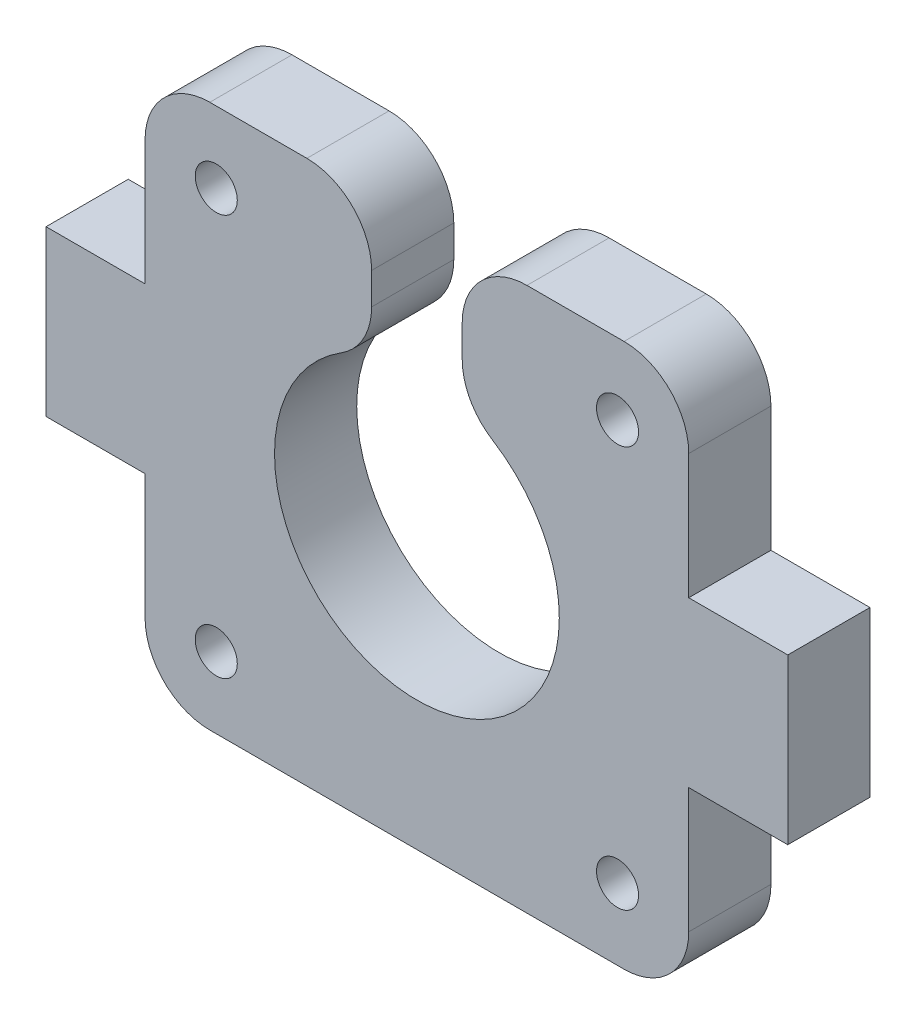
from build123d import *

# Parameters (mm, degrees)
SKETCH1_W                   = 57.3
SKETCH1_H                   = 42
BOSS_EXTRUDE1_DEPTH         = 6.35
TAP_DRILL_FOR_M3X0_5_TAP1_D = 3.25
CUT_EXTRUDE1_DEPTH          = 37.085246293
SKETCH5_W                   = 7.65
SKETCH5_H                   = 14.65
CUT_EXTRUDE2_DEPTH          = 37.085246293
FILLET1_R                   = 5


with BuildPart() as part:
    # Sketch1 → Boss-Extrude1 (new body)
    with BuildSketch(Plane.XY):
        Rectangle(SKETCH1_W, SKETCH1_H)
    extrude(amount=BOSS_EXTRUDE1_DEPTH)

    # Tap Drill for M3x0.5 Tap1 (through all)
    with Locations(Plane.XY.offset(6.35)):
        with Locations((15.5, 15.5), (15.5, -15.5), (-15.5, 15.5), (-15.5, -15.5)):
            Hole(TAP_DRILL_FOR_M3X0_5_TAP1_D / 2)

    # Sketch4 → Cut-Extrude1 (cut, through all)
    with BuildSketch(Plane.XY.offset(6.35)):
        with BuildLine():
            ThreePointArc((11, 0), (8.93028555, 6.422616289), (3.5, 10.428326807))
            Line((3.5, 10.428326807), (-3.5, 10.428326807))
            ThreePointArc((-3.5, 10.428326807), (-6.422616289, -8.93028555), (11, 0))
        make_face()
        with BuildLine():
            Line((-3.5, 10.428326807), (3.5, 10.428326807))
            ThreePointArc((3.5, 10.428326807), (0, 11), (-3.5, 10.428326807))
        make_face()
        with BuildLine():
            ThreePointArc((-3.5, 10.428326807), (0, 11), (3.5, 10.428326807))
            Line((3.5, 10.428326807), (3.5, 21))
            Line((3.5, 21), (-3.5, 21))
            Line((-3.5, 21), (-3.5, 10.428326807))
        make_face()
    extrude(amount=-CUT_EXTRUDE1_DEPTH, mode=Mode.SUBTRACT)

    # Sketch5 → Cut-Extrude2 (cut, through all)
    with BuildSketch(Plane.XY.offset(6.35)):
        with Locations((-24.825, 13.675)):
            Rectangle(SKETCH5_W, SKETCH5_H)
        with Locations((-24.825, -13.675)):
            Rectangle(SKETCH5_W, SKETCH5_H)
    cut_extrude2 = extrude(amount=-CUT_EXTRUDE2_DEPTH, mode=Mode.SUBTRACT)

    # Mirror1: Cut-Extrude2 across plane
    add(cut_extrude2.mirror(Plane(origin=(0, 0, 0), x_dir=(0, 0, 1), z_dir=(1, 0, 0))), mode=Mode.SUBTRACT)

    # Fillet1
    fillet1_edges = [part.edges().sort_by_distance(p)[0] for p in [
        (3.5, 10.428326807, 3.175),
        (-3.5, 10.428326807, 3.175),
        (-3.5, 21, 3.175),
        (3.5, 21, 3.175),
        (-21, 21, 3.175),
        (-21, -21, 3.175),
        (21, 21, 3.175),
        (21, -21, 3.175),
    ]]
    fillet(fillet1_edges, radius=FILLET1_R)


solid = part.part
